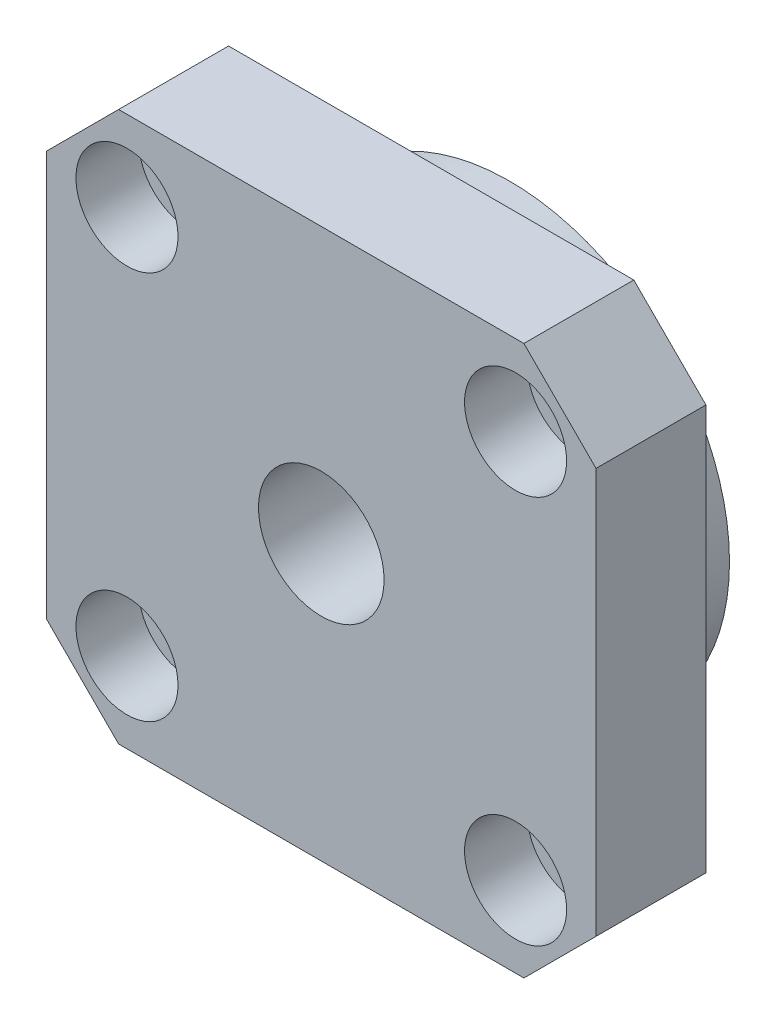
from build123d import *

# Parameters (mm, degrees)
SKETCH_1_R          = 14
SKETCH_1_R_2        = 4
EXTRUDE_1_DEPTH     = 5
SKETCH_2_R          = 4
SKETCH_2_R_2        = 1.7
EXTRUDE_2_DEPTH     = 7
SKETCH_3_R          = 3.25
CUT_EXTRUDE_1_DEPTH = 4
SKETCH_4_R          = 10
CUT_EXTRUDE_2_DEPTH = 5


with BuildPart() as part:
    # 草图1 → 凸台-拉伸1 (new body)
    with BuildSketch(Plane.XY):
        Circle(SKETCH_1_R)
        Circle(SKETCH_1_R_2, mode=Mode.SUBTRACT)
    extrude(amount=EXTRUDE_1_DEPTH)

    # 草图2 → 凸台-拉伸2 (add)
    with BuildSketch(Plane.XY.offset(5)):
        Polygon((-17.5, 12.905591591), (-12.905591591, 17.5), (12.905591591, 17.5), (17.5, 12.905591591), (17.5, -12.905591591), (12.905591591, -17.5), (-12.905591591, -17.5), (-17.5, -12.905591591), align=None)
        Circle(SKETCH_2_R, mode=Mode.SUBTRACT)
        with Locations((-12.374368671, 12.374368671)):
            Circle(SKETCH_2_R_2, mode=Mode.SUBTRACT)
        with Locations((12.374368671, 12.374368671)):
            Circle(SKETCH_2_R_2, mode=Mode.SUBTRACT)
        with Locations((12.374368671, -12.374368671)):
            Circle(SKETCH_2_R_2, mode=Mode.SUBTRACT)
        with Locations((-12.374368671, -12.374368671)):
            Circle(SKETCH_2_R_2, mode=Mode.SUBTRACT)
    extrude(amount=EXTRUDE_2_DEPTH)

    # 草图3 → 切除-拉伸1 (cut)
    with BuildSketch(Plane.XY.offset(12)):
        with Locations((-12.374368671, 12.374368671)):
            Circle(SKETCH_3_R)
        with Locations((12.374368671, 12.374368671)):
            Circle(SKETCH_3_R)
        with Locations((12.374368671, -12.374368671)):
            Circle(SKETCH_3_R)
        with Locations((-12.374368671, -12.374368671)):
            Circle(SKETCH_3_R)
    extrude(amount=-CUT_EXTRUDE_1_DEPTH, mode=Mode.SUBTRACT)

    # 草图4 → 切除-拉伸2 (cut)
    with BuildSketch(Plane(origin=(0, 0, 0), x_dir=(-1, 0, 0), z_dir=(0, 0, -1))):
        Circle(SKETCH_4_R)
    extrude(amount=-CUT_EXTRUDE_2_DEPTH, mode=Mode.SUBTRACT)


solid = part.part
